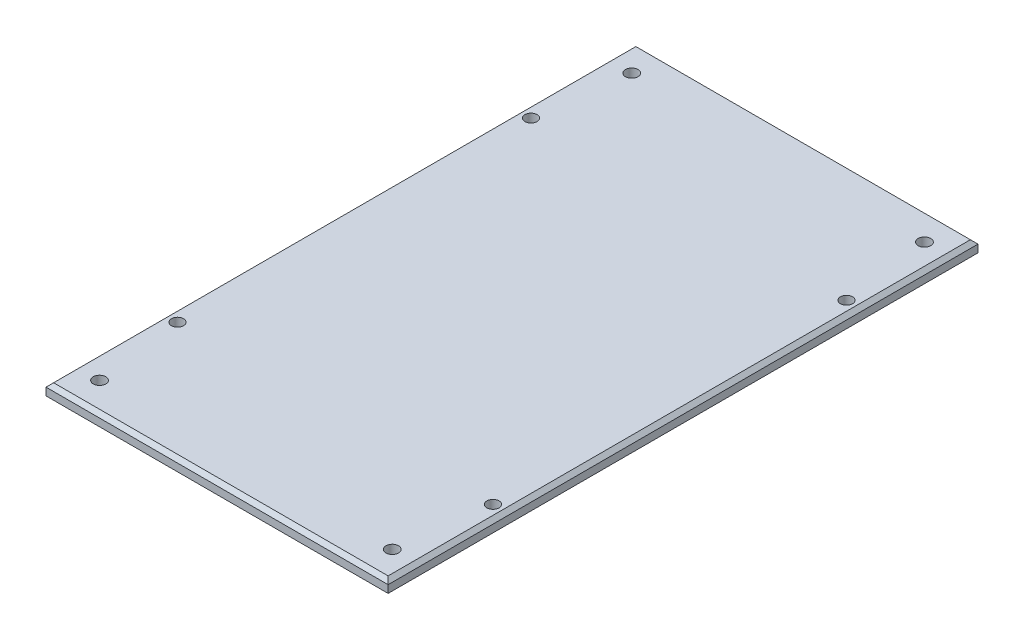
from build123d import *

# Parameters (mm, degrees)
SKETCH1_W           = 90
SKETCH1_H           = 155.172413794
SKETCH1_R           = 1.655172414
BOSS_EXTRUDE1_DEPTH = 3
CUT_EXTRUDE1_DEPTH  = 90.741960646
CHAMFER1_SIZE       = 1
CHAMFER2_SIZE       = 1


with BuildPart() as part:
    # Sketch1 → Boss-Extrude1 (new body)
    with BuildSketch(Plane(origin=(0, 0, 0), x_dir=(1, 0, 0), z_dir=(0, 1, 0))):
        Rectangle(SKETCH1_W, SKETCH1_H)
        with Locations(Location((38.5, -70, 0), (0, 0, 270))):
            Circle(SKETCH1_R, mode=Mode.SUBTRACT)
        with Locations(Location((-38.5, -70, 0), (0, 0, 270))):
            Circle(SKETCH1_R, mode=Mode.SUBTRACT)
        with Locations(Location((38.5, 70, 0), (0, 0, 270))):
            Circle(SKETCH1_R, mode=Mode.SUBTRACT)
        with Locations(Location((-38.5, 70, 0), (0, 0, 270))):
            Circle(SKETCH1_R, mode=Mode.SUBTRACT)
    extrude(amount=BOSS_EXTRUDE1_DEPTH)

    # Sketch2 → Cut-Extrude1 (cut, through all)
    with BuildSketch(Plane(origin=(0, 3, 0), x_dir=(1, 0, 0), z_dir=(0, 1, 0))):
        with BuildLine():
            ThreePointArc((-39.9, 46.5), (-42.63137085, 47.63137085), (-41.5, 44.9))
            Line((-41.5, 44.9), (-41.5, 46.5))
            Line((-41.5, 46.5), (-39.9, 46.5))
        make_face()
        with BuildLine():
            Line((-41.5, 46.5), (-41.5, 44.9))
            ThreePointArc((-41.5, 44.9), (-40.36862915, 45.36862915), (-39.9, 46.5))
            Line((-39.9, 46.5), (-41.5, 46.5))
        make_face()
        with BuildLine():
            ThreePointArc((39.9, 46.5), (40.36862915, 45.36862915), (41.5, 44.9))
            Line((41.5, 44.9), (41.5, 46.5))
            Line((41.5, 46.5), (39.9, 46.5))
        make_face()
        with BuildLine():
            Line((41.5, 46.5), (41.5, 44.9))
            ThreePointArc((41.5, 44.9), (42.63137085, 45.36862915), (43.1, 46.5))
            ThreePointArc((43.1, 46.5), (41.5, 48.1), (39.9, 46.5))
            Line((39.9, 46.5), (41.5, 46.5))
        make_face()
        with BuildLine():
            ThreePointArc((41.5, -44.9), (40.36862915, -45.36862915), (39.9, -46.5))
            Line((39.9, -46.5), (41.5, -46.5))
            Line((41.5, -46.5), (41.5, -44.9))
        make_face()
        with BuildLine():
            Line((41.5, -46.5), (39.9, -46.5))
            ThreePointArc((39.9, -46.5), (41.5, -48.1), (43.1, -46.5))
            ThreePointArc((43.1, -46.5), (42.63137085, -45.36862915), (41.5, -44.9))
            Line((41.5, -44.9), (41.5, -46.5))
        make_face()
        with BuildLine():
            Line((-41.5, -44.9), (-41.5, -46.5))
            Line((-41.5, -46.5), (-39.9, -46.5))
            ThreePointArc((-39.9, -46.5), (-40.36862915, -45.36862915), (-41.5, -44.9))
        make_face()
        with BuildLine():
            Line((-39.9, -46.5), (-41.5, -46.5))
            Line((-41.5, -46.5), (-41.5, -44.9))
            ThreePointArc((-41.5, -44.9), (-42.63137085, -47.63137085), (-39.9, -46.5))
        make_face()
    extrude(amount=-CUT_EXTRUDE1_DEPTH, mode=Mode.SUBTRACT)

    # Chamfer1
    chamfer1_edges = [part.edges().sort_by_distance(p)[0] for p in [
        (0, 3, 77.586206897),
        (0, 3, -77.586206897),
    ]]
    chamfer(chamfer1_edges, length=CHAMFER1_SIZE)

    # Chamfer2
    chamfer2_edges = [part.edges().sort_by_distance(p)[0] for p in [
        (45, 3, 0),
        (-45, 3, 0),
    ]]
    chamfer(chamfer2_edges, length=CHAMFER2_SIZE)


solid = part.part
